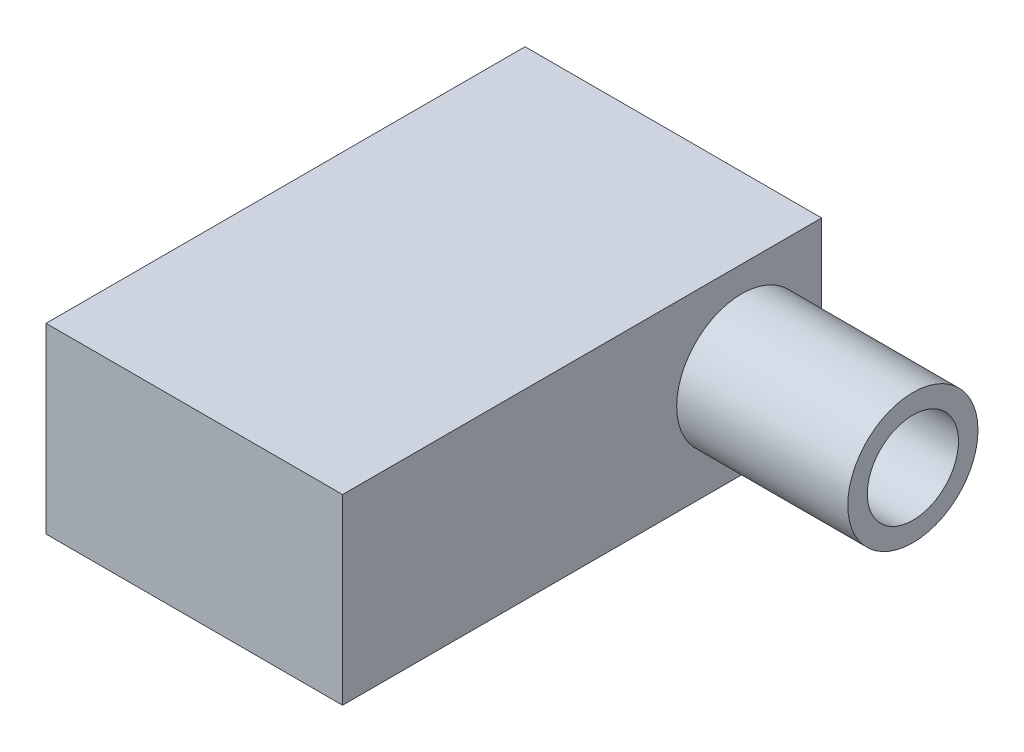
from build123d import *

# Parameters (mm, degrees)
SKETCH1_W           = 130
SKETCH1_H           = 80
SKETCH1_W_2         = 110
SKETCH1_H_2         = 60
BOSS_EXTRUDE2_DEPTH = 200
SKETCH4_W           = 130
SKETCH4_H           = 80
BOSS_EXTRUDE3_DEPTH = 10
SKETCH6_R           = 28.535717896
SKETCH6_R_2         = 19.989594855
BOSS_EXTRUDE5_DEPTH = 75
CUT_EXTRUDE1_START  = -75
SKETCH6_3_R         = 19.989594855
CUT_EXTRUDE1_DEPTH  = 75


with BuildPart() as part:
    # Sketch1 → Boss-Extrude2 (new body)
    with BuildSketch(Plane.XY):
        with Locations((65, -40)):
            Rectangle(SKETCH1_W, SKETCH1_H)
        with Locations((65, -40)):
            Rectangle(SKETCH1_W_2, SKETCH1_H_2, mode=Mode.SUBTRACT)
    extrude(amount=BOSS_EXTRUDE2_DEPTH)

    # Sketch4 → Boss-Extrude3 (add)
    with BuildSketch(Plane.XY.offset(200)):
        with Locations((65, -40)):
            Rectangle(SKETCH4_W, SKETCH4_H)
    extrude(amount=BOSS_EXTRUDE3_DEPTH)

    # Sketch6 → Boss-Extrude5 (add)
    with BuildSketch(Plane(origin=(130, 0, 0), x_dir=(0, 0, -1), z_dir=(1, 0, 0))):
        with Locations((-35.002467087, -39.78091539)):
            Circle(SKETCH6_R)
        with Locations((-35.002467087, -39.78091539)):
            Circle(SKETCH6_R_2, mode=Mode.SUBTRACT)
    extrude(amount=BOSS_EXTRUDE5_DEPTH)

    # Sketch6<3> → Cut-Extrude1 (cut)
    with BuildSketch(Plane(origin=(130, 0, 0), x_dir=(0, 0, -1), z_dir=(1, 0, 0)).offset(CUT_EXTRUDE1_START)):
        with Locations((-35.002467087, -39.78091539)):
            Circle(SKETCH6_3_R)
    extrude(amount=CUT_EXTRUDE1_DEPTH, mode=Mode.SUBTRACT)


solid = part.part
